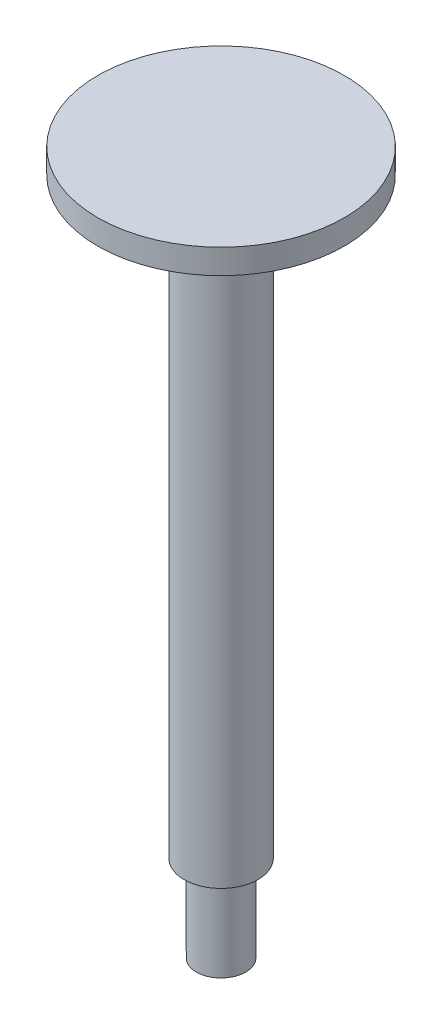
from build123d import *

# Parameters (mm, degrees)
SKETCH_1_R      = 3
EXTRUDE_1_DEPTH = 48
SKETCH_2_R      = 10
EXTRUDE_2_DEPTH = 2
SKETCH_3_R      = 2
EXTRUDE_3_DEPTH = 7


with BuildPart() as part:
    # 草图1 → 凸台-拉伸1 (new body)
    with BuildSketch(Plane(origin=(0, 0, 0), x_dir=(1, 0, 0), z_dir=(0, 1, 0))):
        with Locations(Location((0, 0, 0), (0, 0, 270))):
            Circle(SKETCH_1_R)
    extrude(amount=EXTRUDE_1_DEPTH)

    # 草图2 → 凸台-拉伸2 (add)
    with BuildSketch(Plane(origin=(0, 48, 0), x_dir=(1, 0, 0), z_dir=(0, 1, 0))):
        with Locations(Location((0, 0, 0), (0, 0, 270))):
            Circle(SKETCH_2_R)
    extrude(amount=EXTRUDE_2_DEPTH)

    # 草图3 → 凸台-拉伸3 (add)
    with BuildSketch(Plane.XZ):
        with Locations(Location((0, 0, 0), (0, 0, 90))):
            Circle(SKETCH_3_R)
    extrude(amount=EXTRUDE_3_DEPTH)


solid = part.part
